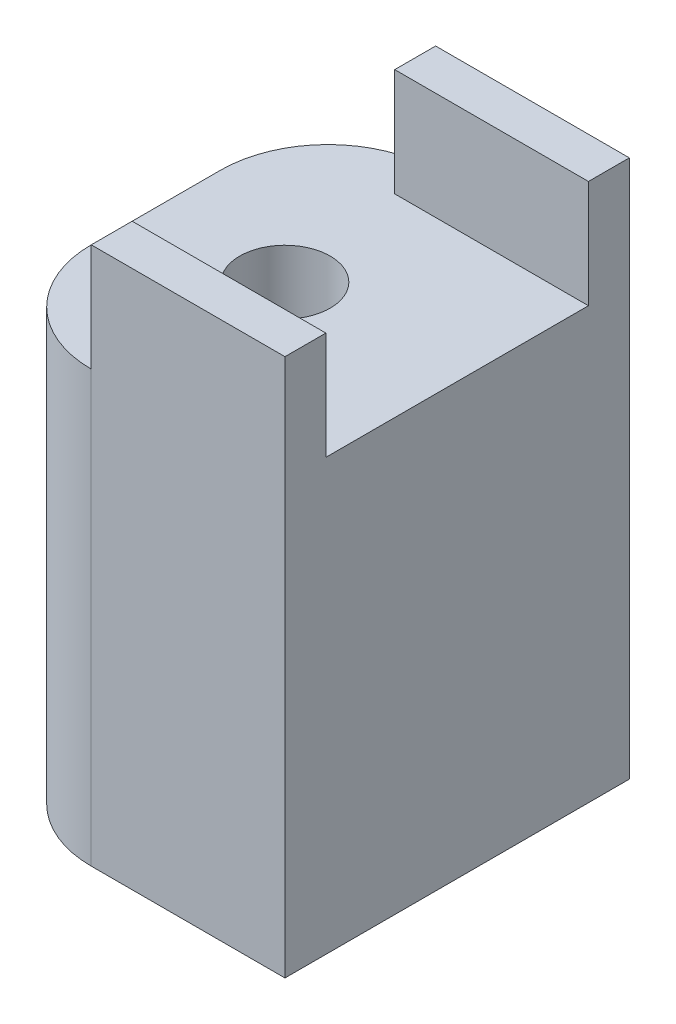
from build123d import *

# Parameters (mm, degrees)
SKETCH1_W           = 12
SKETCH1_H           = 16
SKETCH1_R           = 2.1
SKETCH1_W_2         = 2
BOSS_EXTRUDE1_DEPTH = 20
FILLET1_R           = 5
SKETCH2_W           = 9
SKETCH2_H           = 1.9
BOSS_EXTRUDE2_DEPTH = 5


with BuildPart() as part:
    # Sketch1 → Boss-Extrude1 (new body)
    # profile 1 of 2: a face of its own
    with BuildSketch(Plane(origin=(0, 0, 0), x_dir=(1, 0, 0), z_dir=(0, 1, 0))):
        Rectangle(SKETCH1_W, SKETCH1_H)
        with Locations(Location((0, 0, 0), (0, 0, 270))):
            Circle(SKETCH1_R, mode=Mode.SUBTRACT)
    # profile 2 of 2: a face of its own
    with BuildSketch(Plane(origin=(0, 0, 0), x_dir=(1, 0, 0), z_dir=(0, 1, 0))):
        with Locations((7, 0)):
            Rectangle(SKETCH1_W_2, SKETCH1_H)
    extrude(amount=BOSS_EXTRUDE1_DEPTH)

    # Fillet1
    fillet1_edges = [part.edges().sort_by_distance(p)[0] for p in [
        (-6, 10, 8),
        (-6, 10, -8),
    ]]
    fillet(fillet1_edges, radius=FILLET1_R)

    # Sketch2 → Boss-Extrude2 (add)
    with BuildSketch(Plane(origin=(0, 20, 0), x_dir=(1, 0, 0), z_dir=(0, 1, 0))):
        with Locations((3.5, 7.05)):
            Rectangle(SKETCH2_W, SKETCH2_H)
        with Locations((3.5, -7.05)):
            Rectangle(SKETCH2_W, SKETCH2_H)
    extrude(amount=BOSS_EXTRUDE2_DEPTH)


solid = part.part
